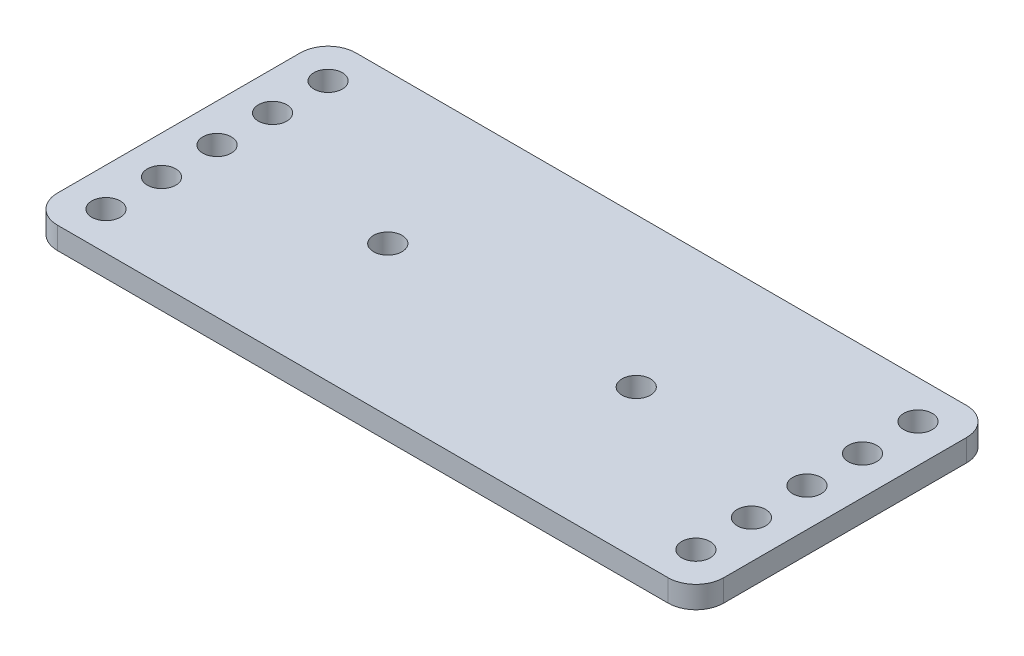
from build123d import *

# Parameters (mm, degrees)
SKETCH1_W           = 96
SKETCH1_H           = 43
SKETCH1_R           = 2.05
BOSS_EXTRUDE1_DEPTH = 3.175
FILLET1_R           = 4


with BuildPart() as part:
    # Sketch1 → Boss-Extrude1 (new body)
    with BuildSketch(Plane(origin=(0, 0, 0), x_dir=(1, 0, 0), z_dir=(0, 1, 0))):
        Rectangle(SKETCH1_W, SKETCH1_H)
        with Locations(Location((-17.9, 0, 0), (0, 0, 270))):
            Circle(SKETCH1_R, mode=Mode.SUBTRACT)
        with Locations(Location((-42.5, 16, 0), (0, 0, 270))):
            Circle(SKETCH1_R, mode=Mode.SUBTRACT)
        with Locations(Location((-42.5, 8, 0), (0, 0, 270))):
            Circle(SKETCH1_R, mode=Mode.SUBTRACT)
        with Locations(Location((-42.5, 0, 0), (0, 0, 270))):
            Circle(SKETCH1_R, mode=Mode.SUBTRACT)
        with Locations(Location((-42.5, -8, 0), (0, 0, 270))):
            Circle(SKETCH1_R, mode=Mode.SUBTRACT)
        with Locations(Location((-42.5, -16, 0), (0, 0, 270))):
            Circle(SKETCH1_R, mode=Mode.SUBTRACT)
        with Locations(Location((42.5, 16, 0), (0, 0, 90))):
            Circle(SKETCH1_R, mode=Mode.SUBTRACT)
        with Locations(Location((42.5, 8, 0), (0, 0, 90))):
            Circle(SKETCH1_R, mode=Mode.SUBTRACT)
        with Locations(Location((42.5, 0, 0), (0, 0, 90))):
            Circle(SKETCH1_R, mode=Mode.SUBTRACT)
        with Locations(Location((42.5, -8, 0), (0, 0, 90))):
            Circle(SKETCH1_R, mode=Mode.SUBTRACT)
        with Locations(Location((42.5, -16, 0), (0, 0, 90))):
            Circle(SKETCH1_R, mode=Mode.SUBTRACT)
        with Locations(Location((17.9, 0, 0), (0, 0, 270))):
            Circle(SKETCH1_R, mode=Mode.SUBTRACT)
    extrude(amount=BOSS_EXTRUDE1_DEPTH)

    # Fillet1
    fillet1_edges = [part.edges().sort_by_distance(p)[0] for p in [
        (-48, 1.5875, -21.5),
        (48, 1.5875, -21.5),
        (48, 1.5875, 21.5),
        (-48, 1.5875, 21.5),
    ]]
    fillet(fillet1_edges, radius=FILLET1_R)


solid = part.part
